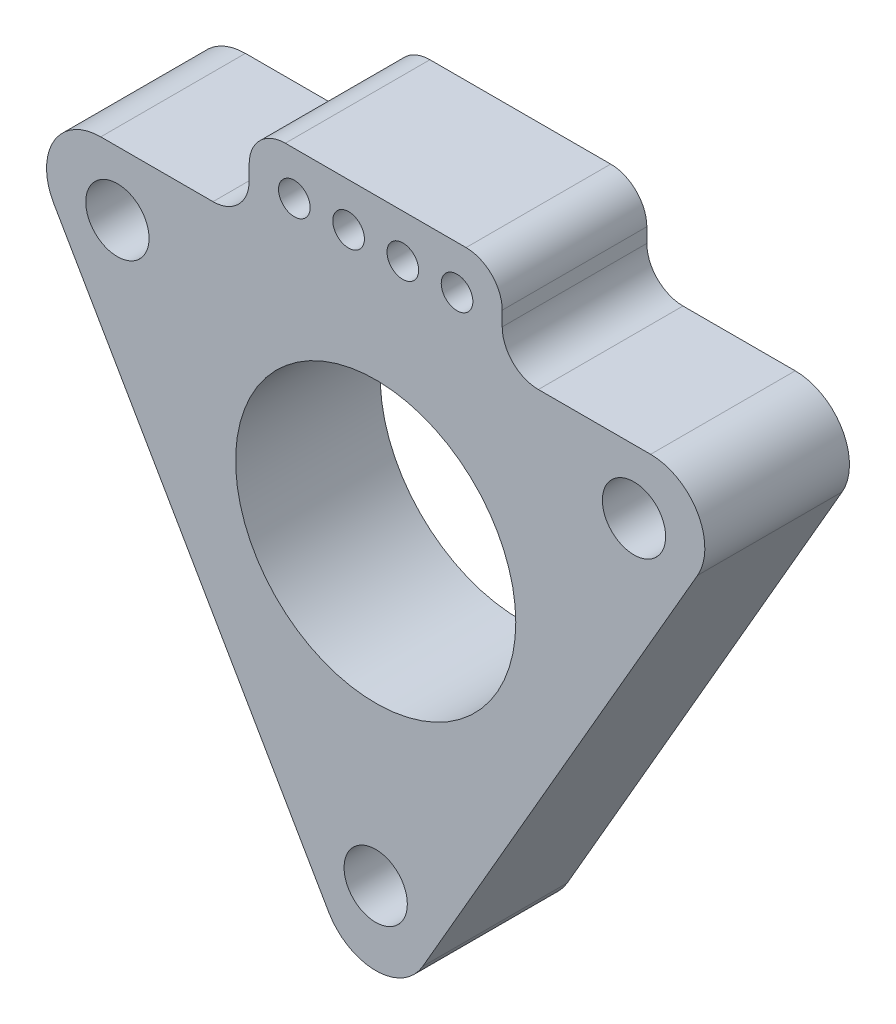
from build123d import *

# Parameters (mm, degrees)
MODEL_R             = 1.7499965
MODEL_R_2           = 7.75
BOSS_EXTRUDE1_DEPTH = 8
FILLET1_R           = 3
SKETCH1_W           = 14
SKETCH1_H           = 4.8
SKETCH1_R           = 0.875
BOSS_EXTRUDE2_DEPTH = 8
FILLET2_R           = 2


with BuildPart() as part:
    # Model → Boss-Extrude1 (new body)
    with BuildSketch(Plane.XY):
        Polygon((20.40532142, 11.78), (-20.40532142, 11.78), (0, -23.563053444), align=None)
        with Locations((0, -16.5)):
            Circle(MODEL_R, mode=Mode.SUBTRACT)
        Circle(MODEL_R_2, mode=Mode.SUBTRACT)
        with Locations((-14.289419163, 8.25)):
            Circle(MODEL_R, mode=Mode.SUBTRACT)
        with Locations((14.289419163, 8.25)):
            Circle(MODEL_R, mode=Mode.SUBTRACT)
    extrude(amount=BOSS_EXTRUDE1_DEPTH)

    # Fillet1
    fillet1_edges = [part.edges().sort_by_distance(p)[0] for p in [
        (0, -23.563053444, 4),
        (-20.40532142, 11.78, 4),
        (20.40532142, 11.78, 4),
    ]]
    fillet(fillet1_edges, radius=FILLET1_R)

    # Sketch1 → Boss-Extrude2 (add)
    with BuildSketch(Plane(origin=(0, 0, 0), x_dir=(-1, 0, 0), z_dir=(0, 0, -1))):
        with Locations((0, 14.18)):
            Rectangle(SKETCH1_W, SKETCH1_H)
        with Locations((-1.5, 14.18)):
            Circle(SKETCH1_R, mode=Mode.SUBTRACT)
        with Locations((-4.5, 14.18)):
            Circle(SKETCH1_R, mode=Mode.SUBTRACT)
        with Locations((1.5, 14.18)):
            Circle(SKETCH1_R, mode=Mode.SUBTRACT)
        with Locations((4.5, 14.18)):
            Circle(SKETCH1_R, mode=Mode.SUBTRACT)
    extrude(amount=-BOSS_EXTRUDE2_DEPTH)

    # Fillet2
    fillet2_edges = [part.edges().sort_by_distance(p)[0] for p in [
        (-7, 11.78, 4),
        (7, 11.78, 4),
        (7, 16.58, 4),
        (-7, 16.58, 4),
    ]]
    fillet(fillet2_edges, radius=FILLET2_R)


solid = part.part
